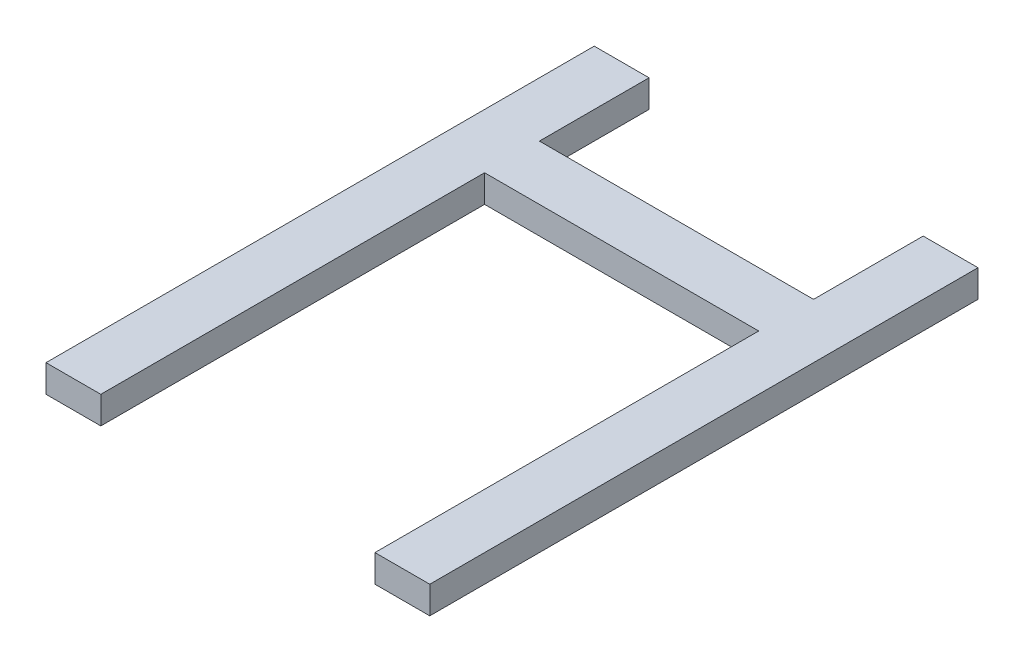
from build123d import *

# Parameters (mm, degrees)
ESQUISSE1_W        = 50
ESQUISSE1_H        = 10
BOSS_EXTRU_1_DEPTH = 5


with BuildPart() as part:
    # Esquisse1 → Boss.-Extru.1 (new body)
    with BuildSketch(Plane(origin=(0, 0, 0), x_dir=(1, 0, 0), z_dir=(0, 1, 0))):
        Polygon((-25, -75), (-25, -5), (-25, 5), (-25, 25), (-35, 25), (-35, -75), align=None)
        Rectangle(ESQUISSE1_W, ESQUISSE1_H)
        Polygon((25, 5), (25, -5), (25, -75), (35, -75), (35, 25), (25, 25), align=None)
    extrude(amount=BOSS_EXTRU_1_DEPTH)


solid = part.part
